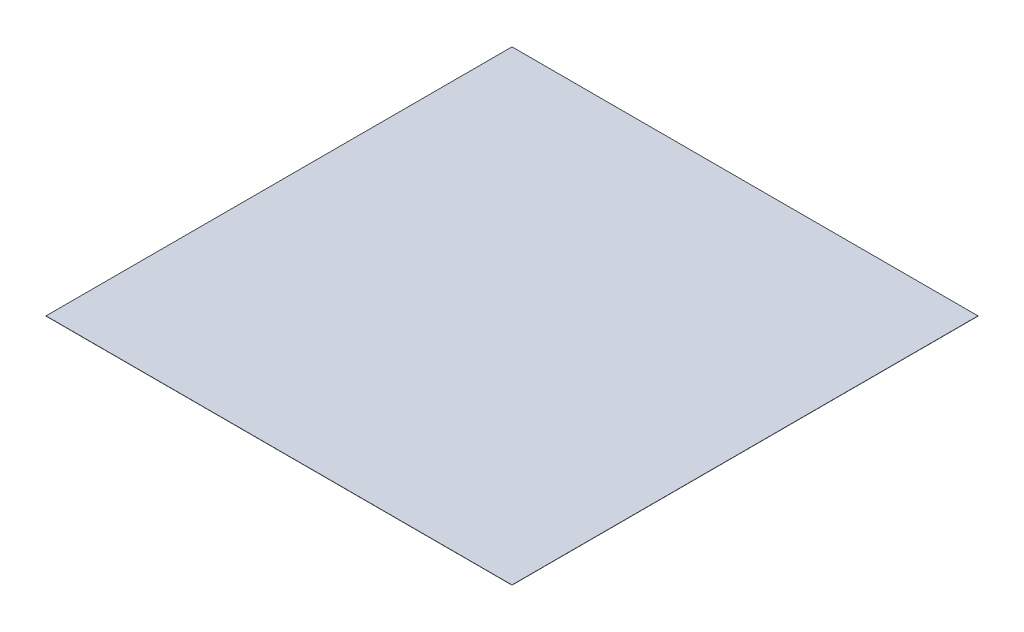
from build123d import *

# Parameters (mm, degrees)
SKETCH_1_W      = 2400
SKETCH_1_H      = 2400
EXTRUDE_1_DEPTH = 1


with BuildPart() as part:
    # 草图1 → 凸台-拉伸1 (new body)
    with BuildSketch(Plane(origin=(0, 0, 0), x_dir=(1, 0, 0), z_dir=(0, 1, 0))):
        Rectangle(SKETCH_1_W, SKETCH_1_H)
    extrude(amount=EXTRUDE_1_DEPTH)


solid = part.part
